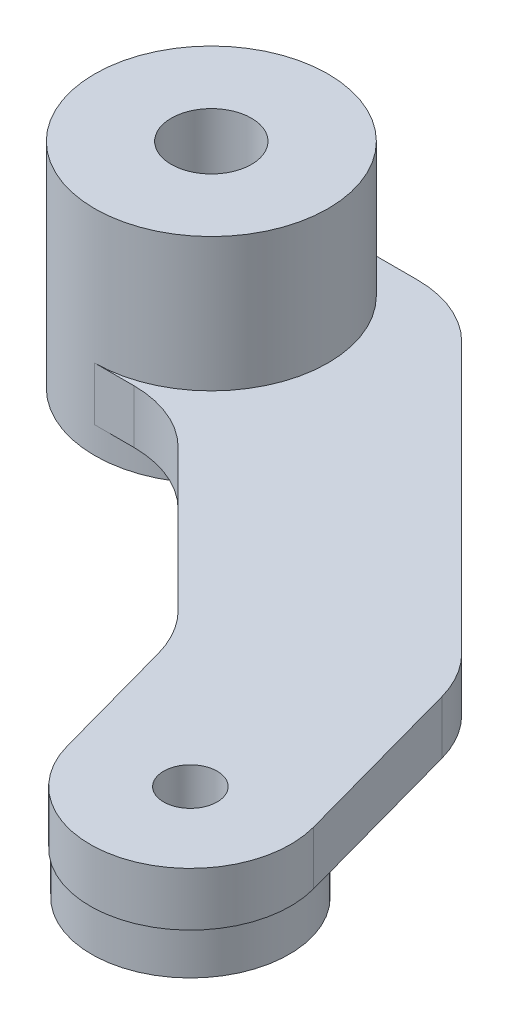
from build123d import *
from build123d.topology import SkipClean

# Parameters (mm, degrees)
SKETCH1_R           = 4.365625
SKETCH1_R_2         = 1.5
SKETCH1_R_3         = 3.75
SKETCH1_R_4         = 1
BOSS_EXTRUDE1_DEPTH = 2
BOSS_EXTRUDE2_START = 1.5875
SKETCH2_R           = 3.697441577
SKETCH2_R_2         = 1
BOSS_EXTRUDE2_DEPTH = 1.5875
SKETCH3_W           = 10.440578203
SKETCH3_H           = 0.489894741
CUT_EXTRUDE1_DEPTH  = 27.994455117
CUT_EXTRUDE3_DEPTH  = 29.041350462
BOSS_EXTRUDE3_START = 1
SKETCH6_R           = 4.365625
SKETCH6_R_2         = 1.5
BOSS_EXTRUDE3_DEPTH = 1
SKETCH7_R           = 4.365625
SKETCH7_R_2         = 1.5
BOSS_EXTRUDE4_DEPTH = 5


with BuildPart() as part:
    # Sketch1 → Boss-Extrude1 (new body)
    # profile 1 of 3: a face of its own
    with BuildSketch(Plane(origin=(0, 0, 0), x_dir=(1, 0, 0), z_dir=(0, 1, 0))):
        with BuildLine():
            Line((3.343145751, 4.365625), (0, 4.365625))
            ThreePointArc((0, 4.365625), (3.086963042, 3.086963042), (4.365625, 0))
            ThreePointArc((4.365625, 0), (3.086963042, -3.086963042), (0, -4.365625))
            Line((0, -4.365625), (1.467794033, -4.365625))
            ThreePointArc((1.467794033, -4.365625), (2.998527762, -4.67010687), (4.296221157, -5.537197875))
            Line((4.296221157, -5.537197875), (9.570119263, -10.81109598))
            ThreePointArc((9.570119263, -10.81109598), (10.198536879, -11.627006165), (10.597804983, -12.576323346))
            Line((10.597804983, -12.576323346), (11.898392678, -17.293417078))
            ThreePointArc((11.898392678, -17.293417078), (14.516748696, -12.681561512), (19.128604262, -15.29991753))
            Line((19.128604262, -15.29991753), (17.301580945, -8.673497591))
            ThreePointArc((17.301580945, -8.673497591), (16.902312841, -7.724180409), (16.273895225, -6.908270225))
            Line((16.273895225, -6.908270225), (6.171572875, 3.194052125))
            ThreePointArc((6.171572875, 3.194052125), (4.87387948, 4.06114313), (3.343145751, 4.365625))
        make_face()
    # profile 2 of 3: a face of its own
    with BuildSketch(Plane(origin=(0, 0, 0), x_dir=(1, 0, 0), z_dir=(0, 1, 0))):
        Circle(SKETCH1_R)
        with Locations(Location((0, 0, 0), (0, 0, 270))):
            Circle(SKETCH1_R_2, mode=Mode.SUBTRACT)
    # profile 3 of 3: a face of its own
    with BuildSketch(Plane(origin=(0, 0, 0), x_dir=(1, 0, 0), z_dir=(0, 1, 0))):
        with Locations((15.51349847, -16.296667304)):
            Circle(SKETCH1_R_3)
        with Locations(Location((15.51349847, -16.296667304, 0), (0, 0, 270))):
            Circle(SKETCH1_R_4, mode=Mode.SUBTRACT)
    extrude(amount=BOSS_EXTRUDE1_DEPTH)

    # Sketch2 → Boss-Extrude2 (add)
    # profile 1 of 2: a face of its own
    with SkipClean():  # the faces are left unmerged after this step: merging them gives an invalid solid
        with BuildSketch(Plane.XZ.offset(BOSS_EXTRUDE2_START)):
            with BuildLine():
                ThreePointArc((14.766930457, 12.675381563), (14.284086567, 12.809602551), (13.823828401, 13.007884965))
                Line((13.823828401, 13.007884965), (12.351641282, 8.832220322))
                Line((12.351641282, 8.832220322), (4.20896111, 0.85370709))
                Line((4.20896111, 0.85370709), (4.908830924, 0.139436662))
                Line((4.908830924, 0.139436662), (13.217481616, 8.280574235))
                Line((13.217481616, 8.280574235), (14.766930457, 12.675381563))
            make_face()
        # profile 2 of 2: a face of its own
        with BuildSketch(Plane.XZ.offset(BOSS_EXTRUDE2_START)):
            with Locations((15.51349847, 16.296667304)):
                Circle(SKETCH2_R)
            with Locations(Location((15.51349847, 16.296667304, 0), (0, 0, 270))):
                Circle(SKETCH2_R_2, mode=Mode.SUBTRACT)
        extrude(amount=-BOSS_EXTRUDE2_DEPTH)

    # Sketch3 → Cut-Extrude1 (cut, through all)
    with SkipClean():  # the faces are left unmerged after this step: merging them gives an invalid solid
        with BuildSketch(Plane(origin=(9.159515606, 0, -3.229311271), x_dir=(-0.33250340190554584, 0, -0.9431020558355491), z_dir=(0.9431020558355491, 0, -0.33250340190554584))):
            with Locations((-6.983995086, -1.34255263)):
                Rectangle(SKETCH3_W, SKETCH3_H)
            Polygon((-12.204284187, -1.097605259), (-16.864233023, -1.5875), (-12.204284187, -1.5875), align=None)
        extrude(amount=-CUT_EXTRUDE1_DEPTH, mode=Mode.SUBTRACT)

    # Sketch5 → Cut-Extrude3 (cut, through all)
    with SkipClean():  # the faces are left unmerged after this step: merging them gives an invalid solid
        with BuildSketch(Plane(origin=(1.634858863, 0, -1.668497934), x_dir=(0.7142704274254688, 0, 0.6998698139693111), z_dir=(-0.6998698139693111, 0, 0.7142704274254688))):
            with BuildLine():
                Line((15.003816491, -1.122033372), (4.466951764, -0.046116385))
                add(Edge.make_bspline(
                    [(3.855909999, 0), (4.032985789, 0), (4.289562434, -0.028003199), (4.466951764, -0.046116385)],
                    knots=[0, 0, 0, 0, 1, 1, 1, 1], degree=3))
                Line((3.855909999, 0), (3.579570092, 0))
                Line((3.579570092, 0), (3.579570092, -1.146381057))
                Line((3.579570092, -1.146381057), (15.003816491, -1.122033372))
            make_face()
        extrude(amount=-CUT_EXTRUDE3_DEPTH, mode=Mode.SUBTRACT)

    # Sketch6 → Boss-Extrude3 (add)
    with SkipClean():  # the faces are left unmerged after this step: merging them gives an invalid solid
        with BuildSketch(Plane.XZ.offset(BOSS_EXTRUDE3_START)):
            with Locations(Location((0, 0, 0), (0, 0, 270))):
                Circle(SKETCH6_R)
            with Locations(Location((0, 0, 0), (0, 0, 270))):
                Circle(SKETCH6_R_2, mode=Mode.SUBTRACT)
        extrude(amount=-BOSS_EXTRUDE3_DEPTH)

    # Sketch7 → Boss-Extrude4 (add)
    with BuildSketch(Plane(origin=(0, 2, 0), x_dir=(1, 0, 0), z_dir=(0, 1, 0))):
        with Locations(Location((0, 0, 0), (0, 0, 90))):
            Circle(SKETCH7_R)
        with Locations(Location((0, 0, 0), (0, 0, 90))):
            Circle(SKETCH7_R_2, mode=Mode.SUBTRACT)
    extrude(amount=BOSS_EXTRUDE4_DEPTH)


solid = part.part
